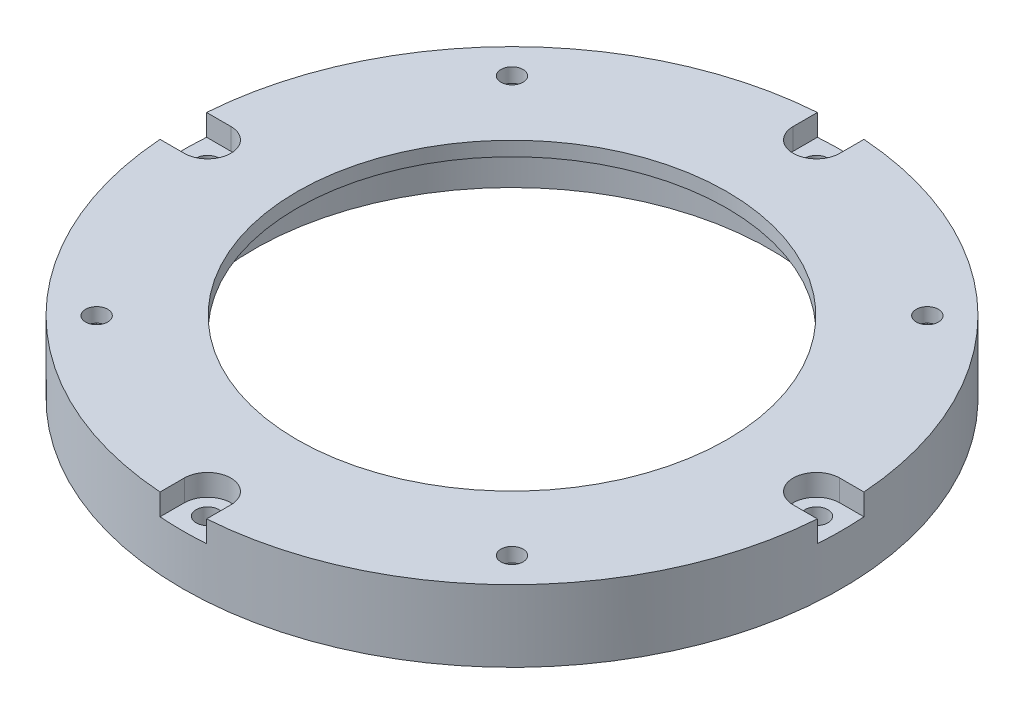
from build123d import *

# Parameters (mm, degrees)
SKETCH1_R                      = 46
SKETCH1_R_2                    = 36.05
SKETCH1_R_3                    = 30
BOSS_EXTRUDE1_DEPTH            = 2
BOSS_EXTRUDE2_START            = -2
SKETCH1_3_R                    = 46
SKETCH1_3_R_2                  = 36.05
BOSS_EXTRUDE2_DEPTH            = 8
CBORE_FOR_M3_SHCS2_D           = 3.2
CBORE_FOR_M3_SHCS2_CBORE_D     = 6.5
CBORE_FOR_M3_SHCS2_CBORE_DEPTH = 3
SKETCH8_R                      = 3.25
SKETCH8_W                      = 10
SKETCH8_H                      = 6.5
CUT_EXTRUDE1_DEPTH             = 66.429351212
CIRPATTERN1_COUNT              = 4
SKETCH9_R                      = 1.55
CUT_EXTRUDE2_DEPTH             = 66.817930688
CUT_EXTRUDE3_START             = -2
SKETCH9_3_R                    = 1.55
CUT_EXTRUDE3_DEPTH             = 64.817930688
CIRPATTERN2_COUNT              = 4


with BuildPart() as part:
    # Sketch1 → Boss-Extrude1 (new body)
    # profile 1 of 2: a face of its own
    with BuildSketch(Plane(origin=(0, 0, 0), x_dir=(1, 0, 0), z_dir=(0, 1, 0))):
        with Locations(Location((0, 0, 0), (0, 0, 270))):
            Circle(SKETCH1_R)
        Circle(SKETCH1_R_2, mode=Mode.SUBTRACT)
    # profile 2 of 2: a face of its own
    with BuildSketch(Plane(origin=(0, 0, 0), x_dir=(1, 0, 0), z_dir=(0, 1, 0))):
        Circle(SKETCH1_R_2)
        with Locations(Location((0, 0, 0), (0, 0, 270))):
            Circle(SKETCH1_R_3, mode=Mode.SUBTRACT)
    extrude(amount=-BOSS_EXTRUDE1_DEPTH)

    # Sketch1<3> → Boss-Extrude2 (add)
    with BuildSketch(Plane(origin=(0, 0, 0), x_dir=(1, 0, 0), z_dir=(0, 1, 0)).offset(BOSS_EXTRUDE2_START)):
        with Locations(Location((0, 0, 0), (0, 0, 270))):
            Circle(SKETCH1_3_R)
        with Locations(Location((0, 0, 0), (0, 0, 270))):
            Circle(SKETCH1_3_R_2, mode=Mode.SUBTRACT)
    extrude(amount=-BOSS_EXTRUDE2_DEPTH)

    # CBORE for M3 SHCS2 (through all)
    with Locations(Plane(origin=(0, 0, 0), x_dir=(1, 0, 0), z_dir=(0, 1, 0))):
        with Locations((-42.5, 0)):
            cbore_for_m3_shcs2 = CounterBoreHole(CBORE_FOR_M3_SHCS2_D / 2, CBORE_FOR_M3_SHCS2_CBORE_D / 2, CBORE_FOR_M3_SHCS2_CBORE_DEPTH)

    # Sketch8 → Cut-Extrude1 (cut, through all)
    with BuildSketch(Plane(origin=(0, -3, 0), x_dir=(1, 0, 0), z_dir=(0, 1, 0))):
        with Locations((-42.5, 0)):
            Circle(SKETCH8_R)
        with Locations((-47.5, 0)):
            Rectangle(SKETCH8_W, SKETCH8_H)
    cut_extrude1 = extrude(amount=CUT_EXTRUDE1_DEPTH, mode=Mode.SUBTRACT)

    # CirPattern1: CBORE for M3 SHCS2, Cut-Extrude1 ×4 about axis
    cirpattern1_axis = Axis((0, 0, 0), (0, 1, 0))
    add([cbore_for_m3_shcs2.rotate(cirpattern1_axis, i * 360 / CIRPATTERN1_COUNT) for i in range(1, CIRPATTERN1_COUNT)], mode=Mode.SUBTRACT)
    add([cut_extrude1.rotate(cirpattern1_axis, i * 360 / CIRPATTERN1_COUNT) for i in range(1, CIRPATTERN1_COUNT)], mode=Mode.SUBTRACT)

    # Sketch9 → Cut-Extrude2 (cut, through all)
    with BuildSketch(Plane(origin=(0, 0, 0), x_dir=(1, 0, 0), z_dir=(0, 1, 0))):
        with Locations(Location((28.991378029, 28.991378029, 0), (0, 0, 270))):
            Circle(SKETCH9_R)
    cut_extrude2 = extrude(amount=-CUT_EXTRUDE2_DEPTH, mode=Mode.SUBTRACT)

    # Sketch9<3> → Cut-Extrude3 (cut, through all)
    with BuildSketch(Plane(origin=(0, 0, 0), x_dir=(1, 0, 0), z_dir=(0, 1, 0)).offset(CUT_EXTRUDE3_START)):
        Polygon((32.058604476, 29.813238878), (29.813238878, 32.058604476), (26.746012431, 31.236743626), (25.924151582, 28.169517179), (28.169517179, 25.924151582), (31.236743626, 26.746012431), align=None)
        with Locations(Location((28.991378029, 28.991378029, 0), (0, 0, 270))):
            Circle(SKETCH9_3_R, mode=Mode.SUBTRACT)
    cut_extrude3 = extrude(amount=-CUT_EXTRUDE3_DEPTH, mode=Mode.SUBTRACT)

    # CirPattern2: Cut-Extrude2, Cut-Extrude3 ×4 about axis
    cirpattern2_axis = Axis((0, 0, 0), (0, 1, 0))
    add([cut_extrude2.rotate(cirpattern2_axis, i * 360 / CIRPATTERN2_COUNT) for i in range(1, CIRPATTERN2_COUNT)], mode=Mode.SUBTRACT)
    add([cut_extrude3.rotate(cirpattern2_axis, i * 360 / CIRPATTERN2_COUNT) for i in range(1, CIRPATTERN2_COUNT)], mode=Mode.SUBTRACT)


solid = part.part
